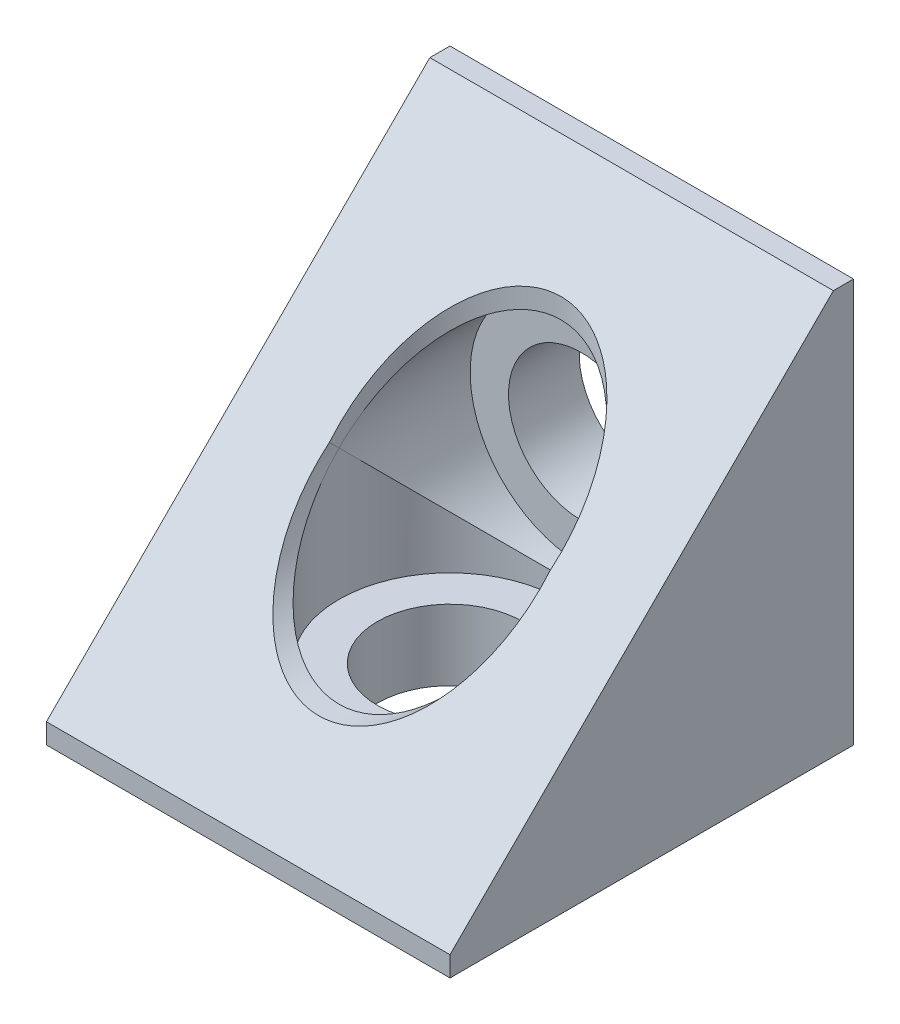
from build123d import *

# Parameters (mm, degrees)
SKETCH1_W           = 20
SKETCH1_H           = 20
SKETCH1_R           = 3.6
BOSS_EXTRUDE1_DEPTH = 10
SKETCH2_R           = 5.5
CUT_EXTRUDE1_DEPTH  = 16.5
SKETCH4_R           = 3.6
CUT_EXTRUDE2_DEPTH  = 25.494897428
SKETCH5_R           = 5.5
CUT_EXTRUDE3_DEPTH  = 16.5
CUT_EXTRUDE4_DEPTH  = 25.494897428


with BuildPart() as part:
    # Sketch1 → Boss-Extrude1 (new, symmetric)
    with BuildSketch(Plane.XY):
        Rectangle(SKETCH1_W, SKETCH1_H)
        Circle(SKETCH1_R, mode=Mode.SUBTRACT)
    extrude(amount=BOSS_EXTRUDE1_DEPTH, both=True)

    # Sketch2 → Cut-Extrude1 (cut)
    with BuildSketch(Plane.XY.offset(10)):
        Circle(SKETCH2_R)
    extrude(amount=-CUT_EXTRUDE1_DEPTH, mode=Mode.SUBTRACT)

    # Sketch4 → Cut-Extrude2 (cut, through all)
    with BuildSketch(Plane(origin=(0, 10, 0), x_dir=(1, 0, 0), z_dir=(0, 1, 0))):
        with Locations(Location((0, 0, 0), (0, 0, 180))):
            Circle(SKETCH4_R)
    extrude(amount=-CUT_EXTRUDE2_DEPTH, mode=Mode.SUBTRACT)

    # Sketch5 → Cut-Extrude3 (cut)
    with BuildSketch(Plane(origin=(0, 10, 0), x_dir=(1, 0, 0), z_dir=(0, 1, 0))):
        with Locations(Location((0, 0, 0), (0, 0, 180))):
            Circle(SKETCH5_R)
    extrude(amount=-CUT_EXTRUDE3_DEPTH, mode=Mode.SUBTRACT)

    # Sketch6 → Cut-Extrude4 (cut, through all)
    with BuildSketch(Plane(origin=(10, 0, 0), x_dir=(0, 0, -1), z_dir=(1, 0, 0))):
        Polygon((-10, -9), (9, 10), (-10, 10), align=None)
    extrude(amount=-CUT_EXTRUDE4_DEPTH, mode=Mode.SUBTRACT)


solid = part.part
